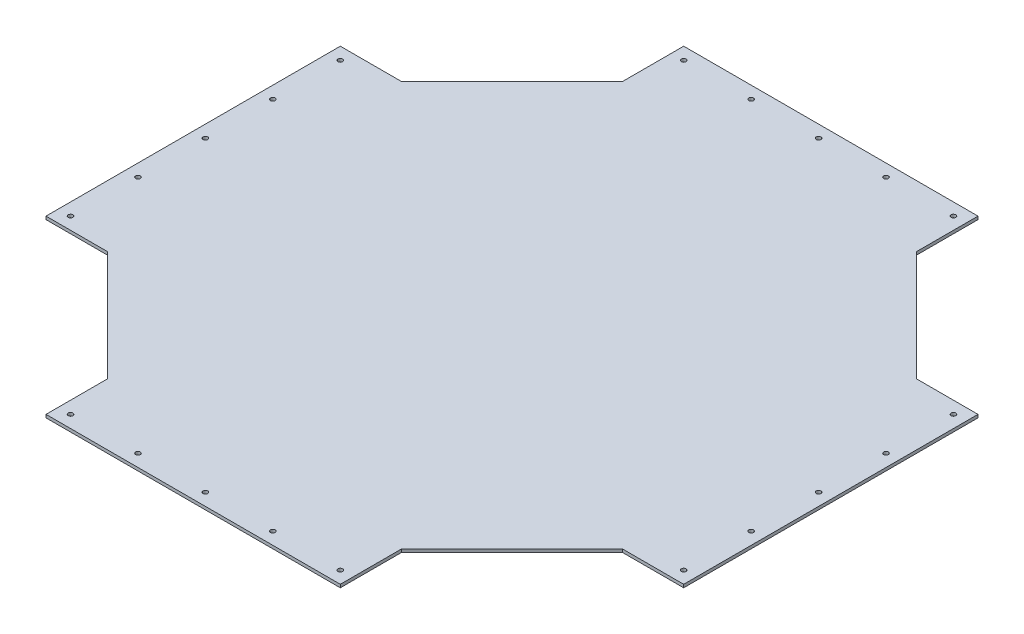
from build123d import *

# Parameters (mm, degrees)
BOSS_EXTRUDE1_DEPTH = 3.175
SKETCH3_R           = 2.4257
CUT_EXTRUDE2_DEPTH  = 3.175


with BuildPart() as part:
    # Sketch1 → Boss-Extrude1 (new body)
    with BuildSketch(Plane(origin=(0, 0, 0), x_dir=(1, 0, 0), z_dir=(0, 1, 0))):
        Polygon((177.8, 596.9), (63.5, 482.6), (0, 482.6), (0, 177.8), (63.5, 177.8), (177.8, 63.5), (177.8, 0), (482.6, 0), (482.6, 63.5), (596.9, 177.8), (660.4, 177.8), (660.4, 482.6), (596.9, 482.6), (482.6, 596.9), (482.6, 660.4), (177.8, 660.4), align=None)
    extrude(amount=BOSS_EXTRUDE1_DEPTH)

    # Sketch3 → Cut-Extrude2 (cut)
    with BuildSketch(Plane(origin=(0, 3.175, 0), x_dir=(1, 0, 0), z_dir=(0, 1, 0))):
        with Locations(Location((190.5, 647.7, 0), (0, 0, 270))):
            Circle(SKETCH3_R)
        with Locations(Location((260.35, 647.7, 0), (0, 0, 270))):
            Circle(SKETCH3_R)
        with Locations(Location((469.9, 647.7, 0), (0, 0, 270))):
            Circle(SKETCH3_R)
        with Locations(Location((400.05, 647.7, 0), (0, 0, 270))):
            Circle(SKETCH3_R)
        with Locations(Location((330.2, 647.7, 0), (0, 0, 270))):
            Circle(SKETCH3_R)
        with Locations(Location((647.7, 469.9, 0), (0, 0, 270))):
            Circle(SKETCH3_R)
        with Locations(Location((647.7, 400.05, 0), (0, 0, 270))):
            Circle(SKETCH3_R)
        with Locations(Location((647.7, 330.2, 0), (0, 0, 270))):
            Circle(SKETCH3_R)
        with Locations(Location((647.7, 260.35, 0), (0, 0, 270))):
            Circle(SKETCH3_R)
        with Locations(Location((647.7, 190.5, 0), (0, 0, 270))):
            Circle(SKETCH3_R)
        with Locations(Location((469.9, 12.7, 0), (0, 0, 270))):
            Circle(SKETCH3_R)
        with Locations(Location((400.05, 12.7, 0), (0, 0, 270))):
            Circle(SKETCH3_R)
        with Locations(Location((330.2, 12.7, 0), (0, 0, 270))):
            Circle(SKETCH3_R)
        with Locations(Location((260.35, 12.7, 0), (0, 0, 270))):
            Circle(SKETCH3_R)
        with Locations(Location((190.5, 12.7, 0), (0, 0, 270))):
            Circle(SKETCH3_R)
        with Locations(Location((12.7, 190.5, 0), (0, 0, 270))):
            Circle(SKETCH3_R)
        with Locations(Location((12.7, 260.35, 0), (0, 0, 270))):
            Circle(SKETCH3_R)
        with Locations(Location((12.7, 330.2, 0), (0, 0, 270))):
            Circle(SKETCH3_R)
        with Locations(Location((12.7, 400.05, 0), (0, 0, 270))):
            Circle(SKETCH3_R)
        with Locations(Location((12.7, 469.9, 0), (0, 0, 270))):
            Circle(SKETCH3_R)
    extrude(amount=-CUT_EXTRUDE2_DEPTH, mode=Mode.SUBTRACT)


solid = part.part
